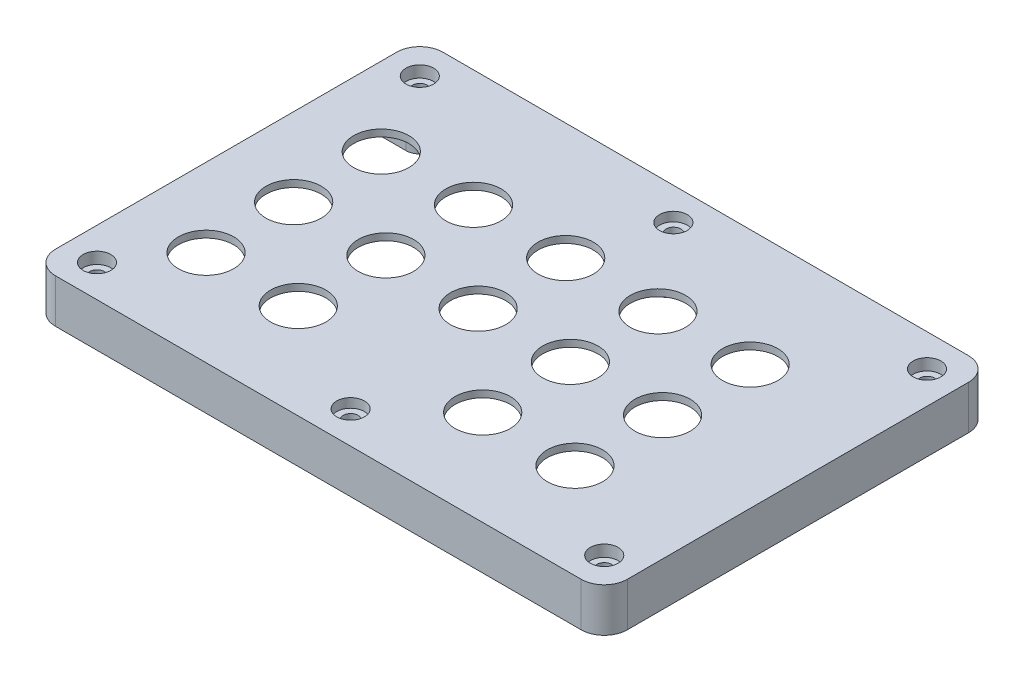
from build123d import *

# Parameters (mm, degrees)
SKETCH1_W           = 124
SKETCH1_H           = 84
BOSS_EXTRUDE1_DEPTH = 9.5
SKETCH2_W           = 118
SKETCH2_H           = 78
CUT_EXTRUDE1_DEPTH  = 8
FILLET1_R           = 2
FILLET2_R           = 5
SKETCH3_R           = 6
CUT_EXTRUDE2_DEPTH  = 2
SKETCH4_W           = 30
SKETCH4_H           = 3.5
CUT_EXTRUDE3_DEPTH  = 4
SKETCH5_W           = 10
SKETCH5_H           = 10
BOSS_EXTRUDE2_DEPTH = 8
FILLET3_R           = 3
SKETCH6_R           = 1.6
CUT_EXTRUDE4_DEPTH  = 9.5
SKETCH7_R           = 3
CUT_EXTRUDE5_DEPTH  = 2.5
SKETCH8_W           = 10
SKETCH8_H           = 10
BOSS_EXTRUDE3_DEPTH = 8
FILLET4_R           = 3
SKETCH9_R           = 1.6
CUT_EXTRUDE6_DEPTH  = 9.5
SKETCH10_R          = 3
CUT_EXTRUDE7_DEPTH  = 2


with BuildPart() as part:
    # Sketch1 → Boss-Extrude1 (new body)
    with BuildSketch(Plane(origin=(0, 0, 0), x_dir=(1, 0, 0), z_dir=(0, 1, 0))):
        with Locations((-420.885550013, -74.097210731)):
            Rectangle(SKETCH1_W, SKETCH1_H)
    extrude(amount=BOSS_EXTRUDE1_DEPTH)

    # Sketch2 → Cut-Extrude1 (cut)
    with BuildSketch(Plane.XZ):
        with Locations((-420.885550013, 74.097210731)):
            Rectangle(SKETCH2_W, SKETCH2_H)
    extrude(amount=-CUT_EXTRUDE1_DEPTH, mode=Mode.SUBTRACT)

    # Fillet1
    fillet1_edges = [part.edges().sort_by_distance(p)[0] for p in [
        (-479.885550013, 4, 35.097210731),
        (-479.885550013, 4, 113.097210731),
        (-361.885550013, 4, 113.097210731),
        (-361.885550013, 4, 35.097210731),
    ]]
    fillet(fillet1_edges, radius=FILLET1_R)

    # Fillet2
    fillet2_edges = [part.edges().sort_by_distance(p)[0] for p in [
        (-482.885550013, 4.75, 32.097210731),
        (-358.885550013, 4.75, 32.097210731),
        (-358.885550013, 4.75, 116.097210731),
        (-482.885550013, 4.75, 116.097210731),
    ]]
    fillet(fillet2_edges, radius=FILLET2_R)

    # Sketch3 → Cut-Extrude2 (cut)
    with BuildSketch(Plane(origin=(0, 9.5, 0), x_dir=(1, 0, 0), z_dir=(0, 1, 0))):
        with Locations(Location((-465.885550013, -57.447210731, 0), (0, 0, 270))):
            Circle(SKETCH3_R)
        with Locations(Location((-445.885550013, -57.447210731, 0), (0, 0, 270))):
            Circle(SKETCH3_R)
        with Locations(Location((-425.885550013, -57.447210731, 0), (0, 0, 270))):
            Circle(SKETCH3_R)
        with Locations(Location((-405.885550013, -57.447210731, 0), (0, 0, 270))):
            Circle(SKETCH3_R)
        with Locations(Location((-385.885550013, -57.447210731, 0), (0, 0, 270))):
            Circle(SKETCH3_R)
        with Locations(Location((-465.885550013, -76.447210731, 0), (0, 0, 270))):
            Circle(SKETCH3_R)
        with Locations(Location((-445.885550013, -76.447210731, 0), (0, 0, 270))):
            Circle(SKETCH3_R)
        with Locations(Location((-425.885550013, -76.447210731, 0), (0, 0, 270))):
            Circle(SKETCH3_R)
        with Locations(Location((-405.885550013, -76.447210731, 0), (0, 0, 270))):
            Circle(SKETCH3_R)
        with Locations(Location((-385.885550013, -76.447210731, 0), (0, 0, 270))):
            Circle(SKETCH3_R)
        with Locations(Location((-465.885550013, -95.447210731, 0), (0, 0, 270))):
            Circle(SKETCH3_R)
        with Locations(Location((-445.885550013, -95.447210731, 0), (0, 0, 270))):
            Circle(SKETCH3_R)
        with Locations(Location((-405.885550013, -95.447210731, 0), (0, 0, 270))):
            Circle(SKETCH3_R)
        with Locations(Location((-385.885550013, -95.447210731, 0), (0, 0, 270))):
            Circle(SKETCH3_R)
    extrude(amount=-CUT_EXTRUDE2_DEPTH, mode=Mode.SUBTRACT)

    # Sketch4 → Cut-Extrude3 (cut)
    with BuildSketch(Plane(origin=(0, 0, 32.097210731), x_dir=(-1, 0, 0), z_dir=(0, 0, -1))):
        with Locations((390.885550013, 1.75)):
            Rectangle(SKETCH4_W, SKETCH4_H)
        with Locations((450.885550013, 1.75)):
            Rectangle(SKETCH4_W, SKETCH4_H)
    extrude(amount=-CUT_EXTRUDE3_DEPTH, mode=Mode.SUBTRACT)

    # Sketch5 → Boss-Extrude2 (add)
    with BuildSketch(Plane.XZ.offset(-8)):
        with Locations((-474.885550013, 108.097210731)):
            Rectangle(SKETCH5_W, SKETCH5_H)
        with Locations((-366.885550013, 108.097210731)):
            Rectangle(SKETCH5_W, SKETCH5_H)
        with Locations((-366.885550013, 40.097210731)):
            Rectangle(SKETCH5_W, SKETCH5_H)
        with Locations((-474.885550013, 40.097210731)):
            Rectangle(SKETCH5_W, SKETCH5_H)
    extrude(amount=BOSS_EXTRUDE2_DEPTH)

    # Fillet3
    fillet3_edges = [part.edges().sort_by_distance(p)[0] for p in [
        (-469.885550013, 4, 103.097210731),
        (-371.885550013, 4, 103.097210731),
        (-371.885550013, 4, 45.097210731),
        (-469.885550013, 4, 45.097210731),
    ]]
    fillet(fillet3_edges, radius=FILLET3_R)

    # Sketch6 → Cut-Extrude4 (cut)
    with BuildSketch(Plane.XZ):
        with Locations(Location((-475.885550013, 109.097210731, 0), (0, 0, 270))):
            Circle(SKETCH6_R)
        with Locations(Location((-365.885550013, 109.097210731, 0), (0, 0, 270))):
            Circle(SKETCH6_R)
        with Locations(Location((-365.885550013, 39.097210731, 0), (0, 0, 270))):
            Circle(SKETCH6_R)
        with Locations(Location((-475.885550013, 39.097210731, 0), (0, 0, 270))):
            Circle(SKETCH6_R)
    extrude(amount=-CUT_EXTRUDE4_DEPTH, mode=Mode.SUBTRACT)

    # Sketch7 → Cut-Extrude5 (cut)
    with BuildSketch(Plane(origin=(0, 9.5, 0), x_dir=(1, 0, 0), z_dir=(0, 1, 0))):
        with Locations(Location((-365.885550013, -39.097210731, 0), (0, 0, 270))):
            Circle(SKETCH7_R)
        with Locations(Location((-365.885550013, -109.097210731, 0), (0, 0, 270))):
            Circle(SKETCH7_R)
        with Locations(Location((-475.885550013, -109.097210731, 0), (0, 0, 270))):
            Circle(SKETCH7_R)
        with Locations(Location((-475.885550013, -39.097210731, 0), (0, 0, 270))):
            Circle(SKETCH7_R)
    extrude(amount=-CUT_EXTRUDE5_DEPTH, mode=Mode.SUBTRACT)

    # Sketch8 → Boss-Extrude3 (add)
    with BuildSketch(Plane.XZ.offset(-8)):
        with Locations((-420.885550013, 40.097210731)):
            Rectangle(SKETCH8_W, SKETCH8_H)
        with Locations((-420.885550013, 108.097210731)):
            Rectangle(SKETCH8_W, SKETCH8_H)
    extrude(amount=BOSS_EXTRUDE3_DEPTH)

    # Fillet4
    fillet4_edges = [part.edges().sort_by_distance(p)[0] for p in [
        (-425.885550013, 4, 45.097210731),
        (-415.885550013, 4, 45.097210731),
        (-425.885550013, 4, 103.097210731),
        (-415.885550013, 4, 103.097210731),
    ]]
    fillet(fillet4_edges, radius=FILLET4_R)

    # Sketch9 → Cut-Extrude6 (cut)
    with BuildSketch(Plane.XZ):
        with Locations(Location((-420.885550013, 39.097210731, 0), (0, 0, 270))):
            Circle(SKETCH9_R)
        with Locations(Location((-420.885550013, 109.097210731, 0), (0, 0, 270))):
            Circle(SKETCH9_R)
    extrude(amount=-CUT_EXTRUDE6_DEPTH, mode=Mode.SUBTRACT)

    # Sketch10 → Cut-Extrude7 (cut)
    with BuildSketch(Plane(origin=(0, 9.5, 0), x_dir=(1, 0, 0), z_dir=(0, 1, 0))):
        with Locations(Location((-420.885550013, -109.097210731, 0), (0, 0, 270))):
            Circle(SKETCH10_R)
        with Locations(Location((-420.885550013, -39.097210731, 0), (0, 0, 270))):
            Circle(SKETCH10_R)
    extrude(amount=-CUT_EXTRUDE7_DEPTH, mode=Mode.SUBTRACT)


solid = part.part
